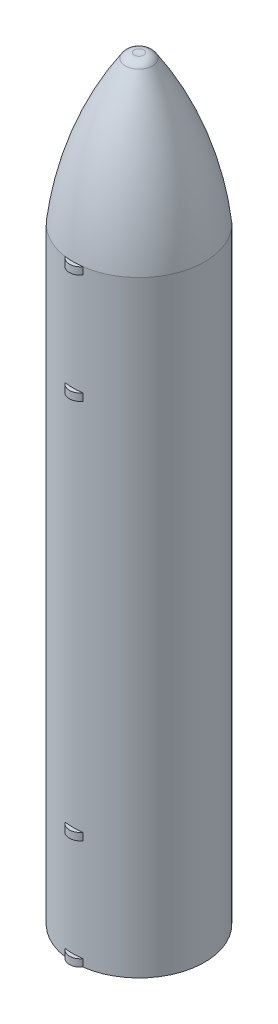
from build123d import *

# Parameters (mm, degrees)
SKETCH1_R            = 4500
BOSS_EXTRUDE1_DEPTH  = 41600
BOSS_EXTRUDE3_DEPTH  = 500
LPATTERN1_COUNT      = 2
LPATTERN1_PITCH      = 7500
MIRROR1_COPY_1_DEPTH = 500


with BuildPart() as part:
    # Sketch1 → Boss-Extrude1 (new body)
    with BuildSketch(Plane(origin=(0, 0, 0), x_dir=(1, 0, 0), z_dir=(0, 1, 0))):
        with Locations(Location((0, 0, 0), (0, 0, 270))):
            Circle(SKETCH1_R)
    extrude(amount=BOSS_EXTRUDE1_DEPTH)

    # Sketch2 → Revolve1 (revolve)
    with BuildSketch(Plane.XY, mode=Mode.PRIVATE) as revolve1_sk:
        with BuildLine():
            Line((0, 51786.186061753), (0, 41600))
            Line((0, 41600), (4500, 41600))
            ThreePointArc((4500, 41600), (3301.877219766, 46740.757920493), (930.357921809, 51456.559698881))
            ThreePointArc((930.357921809, 51456.559698881), (665.199319271, 51698.55834057), (317.070306462, 51786.186061753))
            Line((317.070306462, 51786.186061753), (0, 51786.186061753))
        make_face()
    revolve(revolve1_sk.sketch.rotate(Axis((0, 51786.186061753, 0), (0, -1, 0)), 90), axis=Axis((0, 51786.186061753, 0), (0, -1, 0)))

    # Sketch4 → Boss-Extrude3 (add)
    with BuildSketch(Plane.XZ):
        with BuildLine():
            ThreePointArc((-607.254747717, -4458.83860118), (0, -4768.677640422), (607.254747717, -4458.83860118))
            ThreePointArc((607.254747717, -4458.83860118), (0, -4500), (-607.254747717, -4458.83860118))
        make_face()
        with BuildLine():
            ThreePointArc((-607.254747717, 4458.83860118), (0, 4768.677640422), (607.254747717, 4458.83860118))
            ThreePointArc((607.254747717, 4458.83860118), (0, 4500), (-607.254747717, 4458.83860118))
        make_face()
    boss_extrude3 = extrude(amount=-BOSS_EXTRUDE3_DEPTH)

    # LPattern1: Boss-Extrude3 ×2
    with Locations(*[(0, i * LPATTERN1_PITCH, 0) for i in range(1, LPATTERN1_COUNT)]):
        add(boss_extrude3)

    # Mirror1: Boss-Extrude3 across plane
    add(boss_extrude3.mirror(Plane(origin=(0, 20800, 0), x_dir=(0, 0, 1), z_dir=(0, -1, 0))))

    # Mirror1 copy 1 sketch → Mirror1 copy 1 (add)
    with BuildSketch(Plane(origin=(0, 34100, 0), x_dir=(1, 0, 0), z_dir=(0, 1, 0))):
        with BuildLine():
            ThreePointArc((-607.254747717, 4458.83860118), (0, 4768.677640422), (607.254747717, 4458.83860118))
            ThreePointArc((607.254747717, 4458.83860118), (0, 4500), (-607.254747717, 4458.83860118))
        make_face()
        with BuildLine():
            ThreePointArc((-607.254747717, -4458.83860118), (0, -4768.677640422), (607.254747717, -4458.83860118))
            ThreePointArc((607.254747717, -4458.83860118), (0, -4500), (-607.254747717, -4458.83860118))
        make_face()
    extrude(amount=-MIRROR1_COPY_1_DEPTH)


solid = part.part
